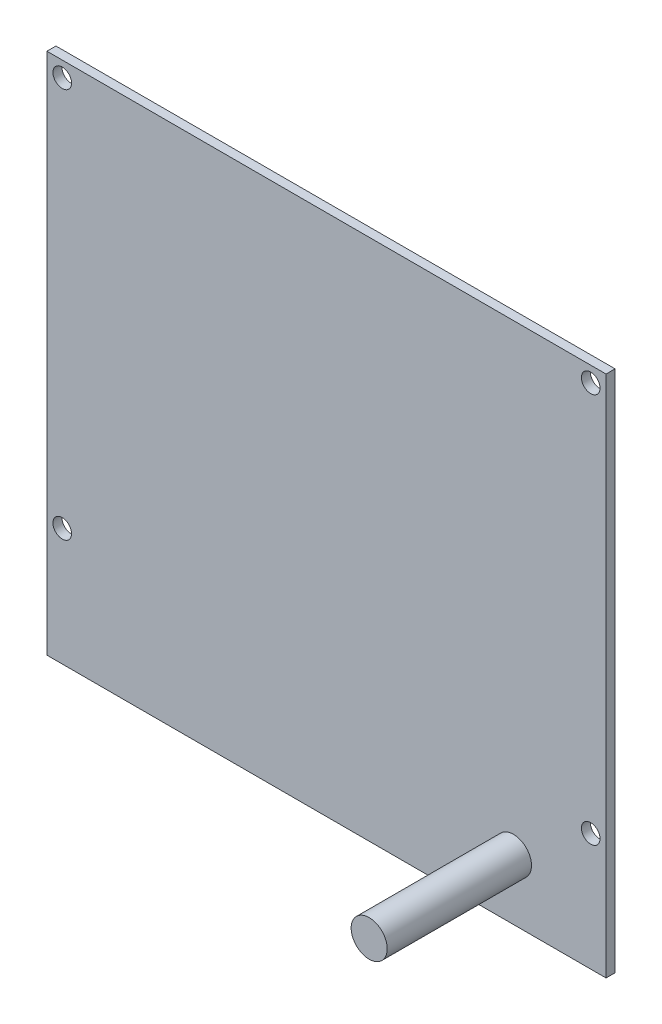
from build123d import *

# Parameters (mm, degrees)
CROQUIS1_W                      = 93
CROQUIS1_H                      = 87
SALIENTE_EXTRUIR1_DEPTH         = 1.5
DI_METRO_DE_TALADRO_3_1_3_1_1_D = 3.1
CROQUIS9_R                      = 3
SALIENTE_EXTRUIR4_DEPTH         = 24


with BuildPart() as part:
    # Croquis1 → Saliente-Extruir1 (new body)
    with BuildSketch(Plane(origin=(0, 0, 0), x_dir=(-1, 0, 0), z_dir=(0, 0, -1))):
        Rectangle(CROQUIS1_W, CROQUIS1_H)
    extrude(amount=-SALIENTE_EXTRUIR1_DEPTH)

    # Diámetro de taladro Ø3.1 (3.1)1 (through all)
    with Locations(Plane(origin=(0, 0, 0), x_dir=(-1, 0, 0), z_dir=(0, 0, -1))):
        with Locations((43.95, -23.95), (-43.95, -23.95), (43.95, 40.95), (-43.95, 40.95)):
            Hole(DI_METRO_DE_TALADRO_3_1_3_1_1_D / 2)

    # Croquis9 → Saliente-Extruir4 (add)
    with BuildSketch(Plane.XY.offset(1.5)):
        with Locations(Location((31.1, -33.5, 0), (0, 0, 180))):
            Circle(CROQUIS9_R)
    extrude(amount=SALIENTE_EXTRUIR4_DEPTH)


solid = part.part
